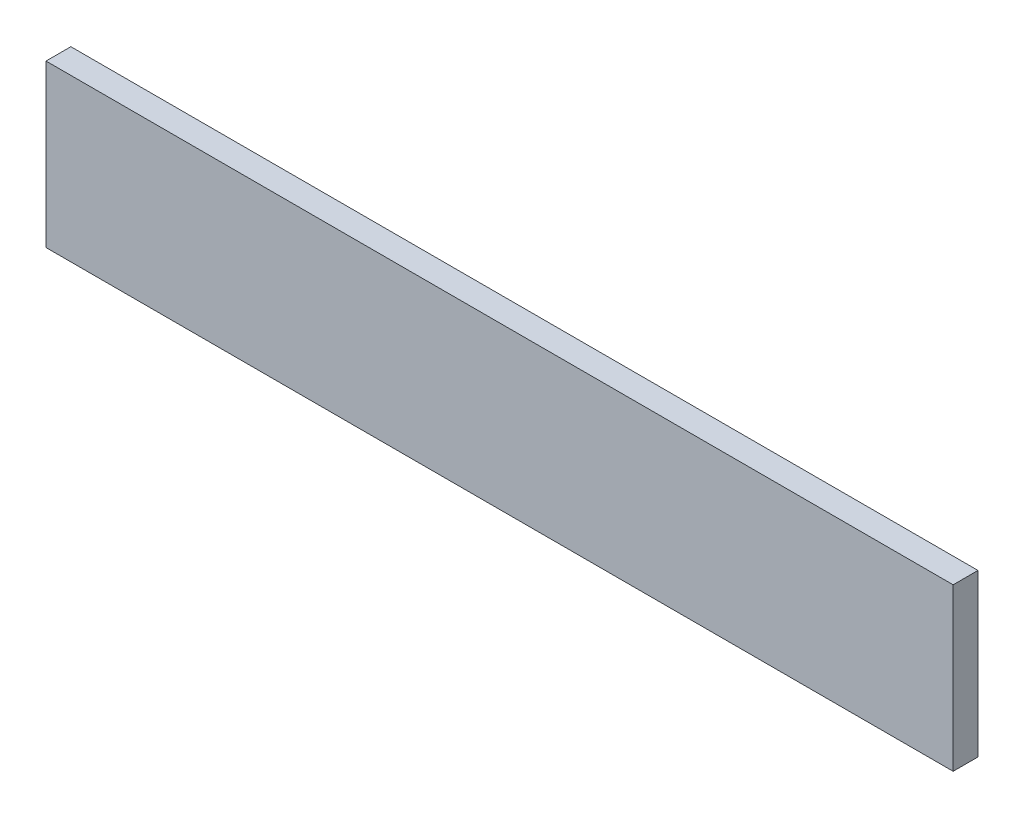
from build123d import *

# Parameters (mm, degrees)
SKETCH1_W           = 231.775
SKETCH1_H           = 41.275
SKETCH1_R           = 7.14375
BOSS_EXTRUDE1_DEPTH = 3.175
SKETCH2_W           = 231.775
SKETCH2_H           = 41.275
BOSS_EXTRUDE2_DEPTH = 6.35


with BuildPart() as part:
    # Sketch1 → Boss-Extrude1 (new, symmetric)
    with BuildSketch(Plane.XY):
        Rectangle(SKETCH1_W, SKETCH1_H)
        with Locations((-95.25, 0)):
            Circle(SKETCH1_R, mode=Mode.SUBTRACT)
        with Locations((-47.625, 0)):
            Circle(SKETCH1_R, mode=Mode.SUBTRACT)
        Circle(SKETCH1_R, mode=Mode.SUBTRACT)
        with Locations((47.625, 0)):
            Circle(SKETCH1_R, mode=Mode.SUBTRACT)
        with Locations((95.25, 0)):
            Circle(SKETCH1_R, mode=Mode.SUBTRACT)
    extrude(amount=BOSS_EXTRUDE1_DEPTH, both=True)

    # Sketch2 → Boss-Extrude2 (add)
    with BuildSketch(Plane.XY.offset(3.175)):
        Rectangle(SKETCH2_W, SKETCH2_H)
    extrude(amount=-BOSS_EXTRUDE2_DEPTH)


solid = part.part
